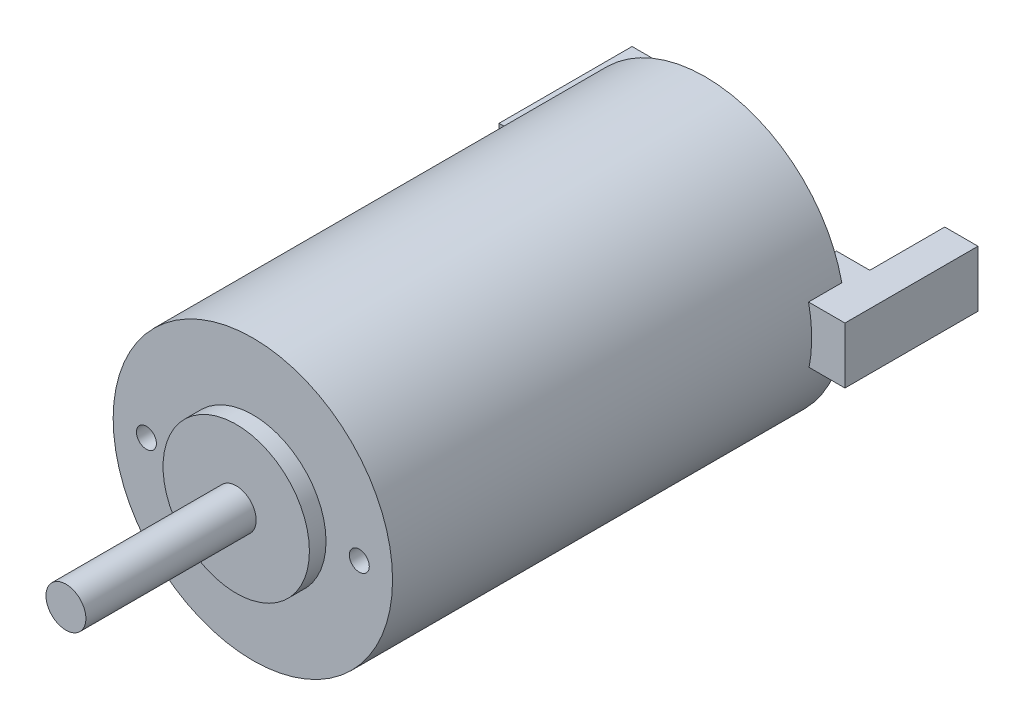
from build123d import *

# Parameters (mm, degrees)
CROQUIS1_R              = 21
SALIENTE_EXTRUIR1_DEPTH = 68
CROQUIS2_R              = 11
SALIENTE_EXTRUIR2_DEPTH = 2.5
CROQUIS3_R              = 3
SALIENTE_EXTRUIR3_DEPTH = 25.6
CROQUIS4_W              = 20
CROQUIS4_H              = 8.467586068
SALIENTE_EXTRUIR4_DEPTH = 5
CROQUIS6_W              = 20
CROQUIS6_H              = 8.467586068
SALIENTE_EXTRUIR5_DEPTH = 5
CORTAR_EXTRUIR1_DEPTH   = 103.753459728
CROQUIS8_R              = 1.5
CORTAR_EXTRUIR2_DEPTH   = 10


with BuildPart() as part:
    # Croquis1 → Saliente-Extruir1 (new body)
    with BuildSketch(Plane.XY):
        Circle(CROQUIS1_R)
    extrude(amount=SALIENTE_EXTRUIR1_DEPTH)

    # Croquis2 → Saliente-Extruir2 (add)
    with BuildSketch(Plane.XY.offset(68)):
        Circle(CROQUIS2_R)
    extrude(amount=SALIENTE_EXTRUIR2_DEPTH)

    # Croquis3 → Saliente-Extruir3 (add)
    with BuildSketch(Plane.XY.offset(70.5)):
        Circle(CROQUIS3_R)
    extrude(amount=SALIENTE_EXTRUIR3_DEPTH)

    # Croquis4 → Saliente-Extruir4 (add, symmetric)
    with BuildSketch(Plane(origin=(21, 0, 0), x_dir=(0, 0, -1), z_dir=(1, 0, 0))):
        with Locations((5, 0.203649565)):
            Rectangle(CROQUIS4_W, CROQUIS4_H)
    extrude(amount=SALIENTE_EXTRUIR4_DEPTH, both=True)

    # Croquis6 → Saliente-Extruir5 (add, symmetric)
    with BuildSketch(Plane(origin=(-21, 0, 0), x_dir=(0, 0, -1), z_dir=(1, 0, 0))):
        with Locations((5, 0.203649565)):
            Rectangle(CROQUIS6_W, CROQUIS6_H)
    extrude(amount=SALIENTE_EXTRUIR5_DEPTH, both=True)

    # Croquis7 → Cortar-Extruir1 (cut, through all)
    with BuildSketch(Plane(origin=(0, 4.437442599, 0), x_dir=(1, 0, 0), z_dir=(0, 1, 0))):
        Polygon((16, 3.735002253), (21, 3.735002253), (21, 15), (-21, 15), (-21, 3.735002253), align=None)
    extrude(amount=-CORTAR_EXTRUIR1_DEPTH, mode=Mode.SUBTRACT)

    # Croquis8 → Cortar-Extruir2 (cut)
    with BuildSketch(Plane.XY.offset(68)):
        with Locations((-16, 0)):
            Circle(CROQUIS8_R)
        with Locations((16, 0)):
            Circle(CROQUIS8_R)
    extrude(amount=-CORTAR_EXTRUIR2_DEPTH, mode=Mode.SUBTRACT)


solid = part.part
